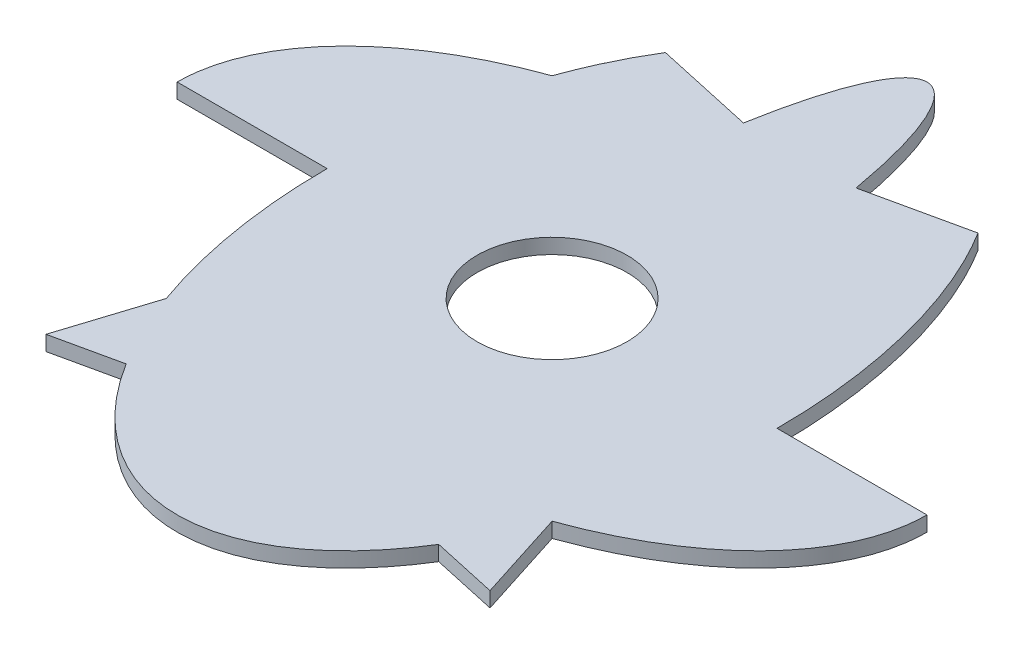
from build123d import *

# Parameters (mm, degrees)
SZKIC1_R                    = 10
DODANIE_WYCI_GNI_CIE1_DEPTH = 2


with BuildPart() as part:
    # Szkic1 → Dodanie-wyciągnięcie1 (new body)
    with BuildSketch(Plane(origin=(0, 0, 0), x_dir=(1, 0, 0), z_dir=(0, 1, 0))):
        with BuildLine():
            add(Edge.make_bspline(
                [(25.724787771, -25.724787771), (50, -16.985711369), (50, 0)],
                knots=[5.252808481, 5.252808481, 5.252808481, 6.283185307, 6.283185307, 6.283185307], degree=2, weights=[1, 0.870199907, 1]))
            Line((50, 0), (30, 0))
            add(Edge.make_bspline(
                [(30, 0), (30, 13.849198247), (25.724787771, 25.724787771)],
                knots=[1.570796327, 1.570796327, 1.570796327, 2.111215827, 2.111215827, 2.111215827], degree=2, weights=[1, 0.963714928, 1]))
            add(Edge.make_bspline(
                [(25.724787771, 25.724787771), (23.68927397, 31.378992774), (20.843852414, 35.960387795)],
                knots=[2.111215827, 2.111215827, 2.111215827, 2.373457716, 2.373457716, 2.373457716], degree=2, weights=[1, 0.991415958, 1]))
            Line((20.843852414, 35.960387795), (7.507535684, 33.029118956))
            add(Edge.make_bspline(
                [(7.507535684, 33.029118956), (5.218865934, 46.034514162), (1.811566447, 49.17271271)],
                knots=[5.433983203, 5.433983203, 5.433983203, 6.101022879, 6.101022879, 6.101022879], degree=2, weights=[1, 0.944895907, 1]))
            add(Edge.make_bspline(
                [(1.811566447, 49.17271271), (0.913339162, 50), (0, 50)],
                knots=[6.101022879, 6.101022879, 6.101022879, 6.283185307, 6.283185307, 6.283185307], degree=2, weights=[1, 0.995854973, 1]))
            add(Edge.make_bspline(
                [(0, 50), (-0.913339162, 50), (-1.811566447, 49.17271271)],
                knots=[0, 0, 0, 0.182162428, 0.182162428, 0.182162428], degree=2, weights=[1, 0.995854973, 1]))
            add(Edge.make_bspline(
                [(-1.811566447, 49.17271271), (-5.218865934, 46.034514162), (-7.507535684, 33.029118956)],
                knots=[0.182162428, 0.182162428, 0.182162428, 0.849202104, 0.849202104, 0.849202104], degree=2, weights=[1, 0.944895907, 1]))
            Line((-7.507535684, 33.029118956), (-20.843852414, 35.960387795))
            add(Edge.make_bspline(
                [(-20.843852414, 35.960387795), (-23.68927397, 31.378992774), (-25.724787771, 25.724787771)],
                knots=[3.909727591, 3.909727591, 3.909727591, 4.17196948, 4.17196948, 4.17196948], degree=2, weights=[1, 0.991415958, 1]))
            add(Edge.make_bspline(
                [(-25.724787771, 25.724787771), (-50, 16.985711369), (-50, 0)],
                knots=[2.111215827, 2.111215827, 2.111215827, 3.141592654, 3.141592654, 3.141592654], degree=2, weights=[1, 0.870199907, 1]))
            Line((-50, 0), (-30, 0))
            add(Edge.make_bspline(
                [(-30, 9.5e-08), (-30.000000016, -13.849198204), (-25.724787771, -25.724787771)],
                knots=[4.712388978, 4.712388978, 4.712388978, 5.252808481, 5.252808481, 5.252808481], degree=2, weights=[1, 0.963714928, 1]))
            Line((-25.724787771, -25.724787771), (-29.607826273, -37.88667404))
            Line((-29.607826273, -37.88667404), (-20.843852414, -35.960387795))
            add(Edge.make_bspline(
                [(-20.843852414, -35.960387795), (-12.774167321, -48.953336072), (-1.56928672, -49.931545896)],
                knots=[5.51505037, 5.51505037, 5.51505037, 6.230851865, 6.230851865, 6.230851865], degree=2, weights=[1, 0.936634273, 1]))
            add(Edge.make_bspline(
                [(-1.56928672, -49.931545896), (-0.785180849, -50), (0, -50)],
                knots=[6.230851865, 6.230851865, 6.230851865, 6.283185307, 6.283185307, 6.283185307], degree=2, weights=[1, 0.999657671, 1]))
            add(Edge.make_bspline(
                [(0, -50), (0.785180849, -50), (1.56928672, -49.931545896)],
                knots=[0, 0, 0, 0.052333442, 0.052333442, 0.052333442], degree=2, weights=[1, 0.999657671, 1]))
            add(Edge.make_bspline(
                [(1.56928672, -49.931545896), (12.774167321, -48.953336072), (20.843852414, -35.960387795)],
                knots=[0.052333442, 0.052333442, 0.052333442, 0.768134938, 0.768134938, 0.768134938], degree=2, weights=[1, 0.936634273, 1]))
            Line((20.843852414, -35.960387795), (29.607826273, -37.88667404))
            Line((29.607826273, -37.88667404), (25.724787771, -25.724787771))
        make_face()
        with Locations(Location((0, 0, 0), (0, 0, 270))):
            Circle(SZKIC1_R, mode=Mode.SUBTRACT)
    extrude(amount=DODANIE_WYCI_GNI_CIE1_DEPTH)


solid = part.part
